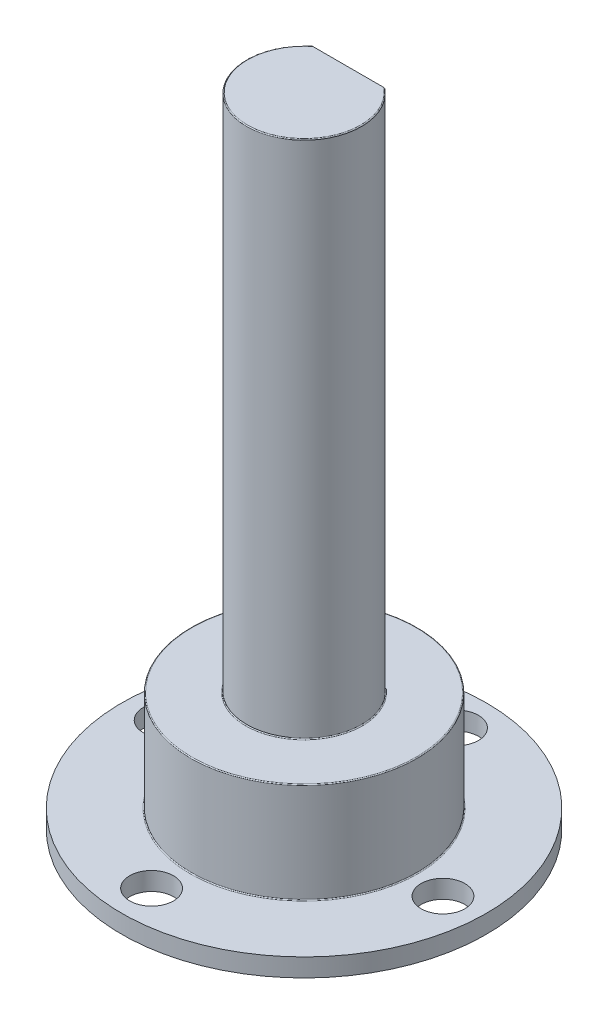
from build123d import *

# Parameters (mm, degrees)
ESQUISSE3_W                  = 6.57785754
ESQUISSE3_H                  = 1.386048805
ENL_V_MAT_EXTRU_1_DEPTH      = 28.5
D_GAGEMENT_M21_D             = 2.4
R_P_TITION_CIRCULAIRE1_COUNT = 4
CONG_1_R                     = 0.05


with BuildPart() as part:
    # Esquisse2 → Révolution2 (revolve)
    with BuildSketch(Plane.XY, mode=Mode.PRIVATE) as r_volution2_sk:
        Polygon((0, 35), (3.15, 35), (3.15, 6.5), (6.2, 6.5), (6.2, 3), (6.2, 1), (10, 1), (10, 0), (4.5, 0), (4.5, 3), (0, 3), align=None)
    revolve(r_volution2_sk.sketch.rotate(Axis((0, 3, 0), (0, 1, 0)), 90), axis=Axis((0, 3, 0), (0, 1, 0)))

    # Esquisse3 → Enlèv. mat.-Extru.1 (cut)
    with BuildSketch(Plane(origin=(0, 35, 0), x_dir=(1, 0, 0), z_dir=(0, 1, 0))):
        with Locations((-0.352413472, 3.114928535)):
            Rectangle(ESQUISSE3_W, ESQUISSE3_H)
    extrude(amount=-ENL_V_MAT_EXTRU_1_DEPTH, mode=Mode.SUBTRACT)

    # Dégagement M21 (through all)
    with Locations(Plane(origin=(0, 1, 0), x_dir=(1, 0, 0), z_dir=(0, 1, 0))):
        with Locations((0.371303159, 7.991378727)):
            d_gagement_m21 = Hole(D_GAGEMENT_M21_D / 2)

    # Répétition circulaire1: Dégagement M21 ×4 about axis
    r_p_tition_circulaire1_axis = Axis((0, 0, 0), (0, 1, 0))
    for i in range(1, R_P_TITION_CIRCULAIRE1_COUNT):
        add(d_gagement_m21.rotate(r_p_tition_circulaire1_axis, i * 360 / R_P_TITION_CIRCULAIRE1_COUNT), mode=Mode.SUBTRACT)

    # Congé1
    cong_1_edges = [part.edges().sort_by_distance(p)[0] for p in [
        (0, 6.5, 6.2),
        (0, 6.5, 3.15),
        (0, 35, 3.15),
        (0, 1, 6.2),
    ]]
    fillet(cong_1_edges, radius=CONG_1_R)


solid = part.part
